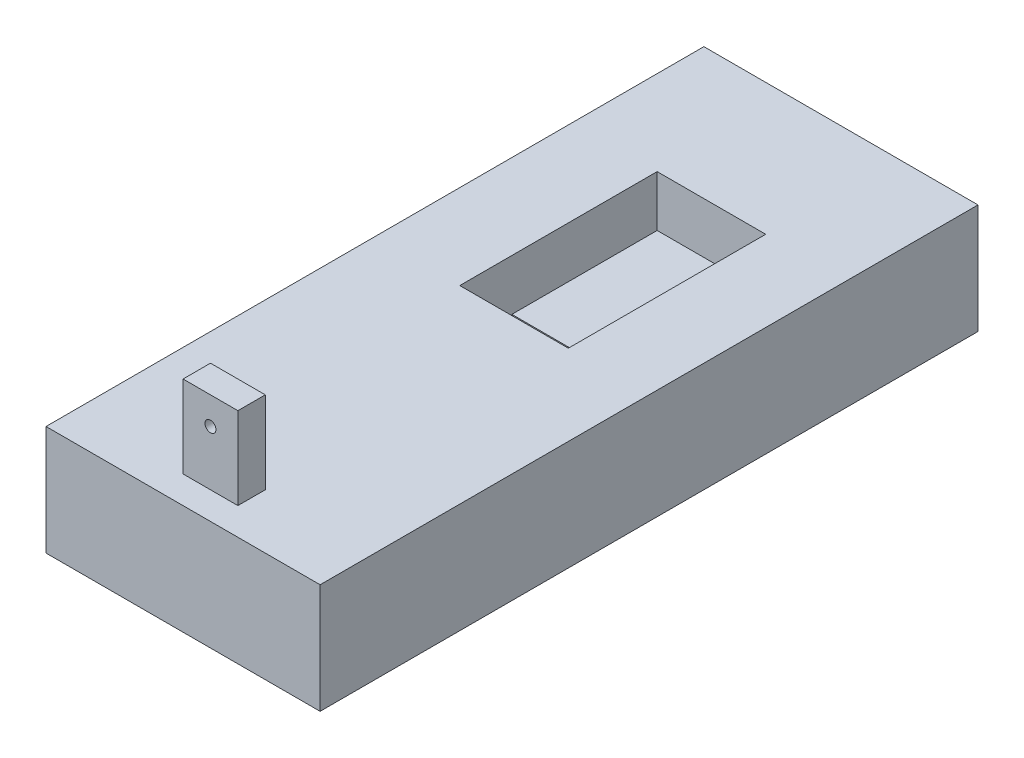
from build123d import *

# Parameters (mm, degrees)
SKETCH1_W           = 50
SKETCH1_H           = 120
BOSS_EXTRUDE1_DEPTH = 20
SKETCH11_W          = 10
SKETCH11_H          = 5
BOSS_EXTRUDE5_DEPTH = 15
SKETCH13_R          = 1
CUT_EXTRUDE3_DEPTH  = 10
SKETCH14_W          = 19.8
SKETCH14_H          = 36
CUT_EXTRUDE4_DEPTH  = 9.3
SKETCH15_W          = 19.8
SKETCH15_H          = 2.5
CUT_EXTRUDE5_DEPTH  = 7.1


with BuildPart() as part:
    # Sketch1 → Boss-Extrude1 (new body)
    with BuildSketch(Plane(origin=(0, 0, 0), x_dir=(1, 0, 0), z_dir=(0, 1, 0))):
        with Locations((-3.706441645, 54.181126694)):
            Rectangle(SKETCH1_W, SKETCH1_H)
    extrude(amount=BOSS_EXTRUDE1_DEPTH)

    # Sketch11 → Boss-Extrude5 (add)
    with BuildSketch(Plane(origin=(0, 20, 0), x_dir=(1, 0, 0), z_dir=(0, 1, 0))):
        with Locations((-3.706441645, 1.681126694)):
            Rectangle(SKETCH11_W, SKETCH11_H)
    extrude(amount=BOSS_EXTRUDE5_DEPTH)

    # Sketch13 → Cut-Extrude3 (cut)
    with BuildSketch(Plane(origin=(0, 0, -4.181126694), x_dir=(-1, 0, 0), z_dir=(0, 0, -1))):
        with Locations((3.706441645, 30)):
            Circle(SKETCH13_R)
    extrude(amount=-CUT_EXTRUDE3_DEPTH, mode=Mode.SUBTRACT)

    # Sketch14 → Cut-Extrude4 (cut)
    with BuildSketch(Plane(origin=(0, 20, 0), x_dir=(1, 0, 0), z_dir=(0, 1, 0))):
        with Locations((-3.331441645, 72.181126694)):
            Rectangle(SKETCH14_W, SKETCH14_H)
    extrude(amount=-CUT_EXTRUDE4_DEPTH, mode=Mode.SUBTRACT)

    # Sketch15 → Cut-Extrude5 (cut)
    with BuildSketch(Plane(origin=(0, 10.7, 0), x_dir=(1, 0, 0), z_dir=(0, 1, 0))):
        with Locations((-3.331441645, 62.431126694)):
            Rectangle(SKETCH15_W, SKETCH15_H)
    extrude(amount=-CUT_EXTRUDE5_DEPTH, mode=Mode.SUBTRACT)


solid = part.part
